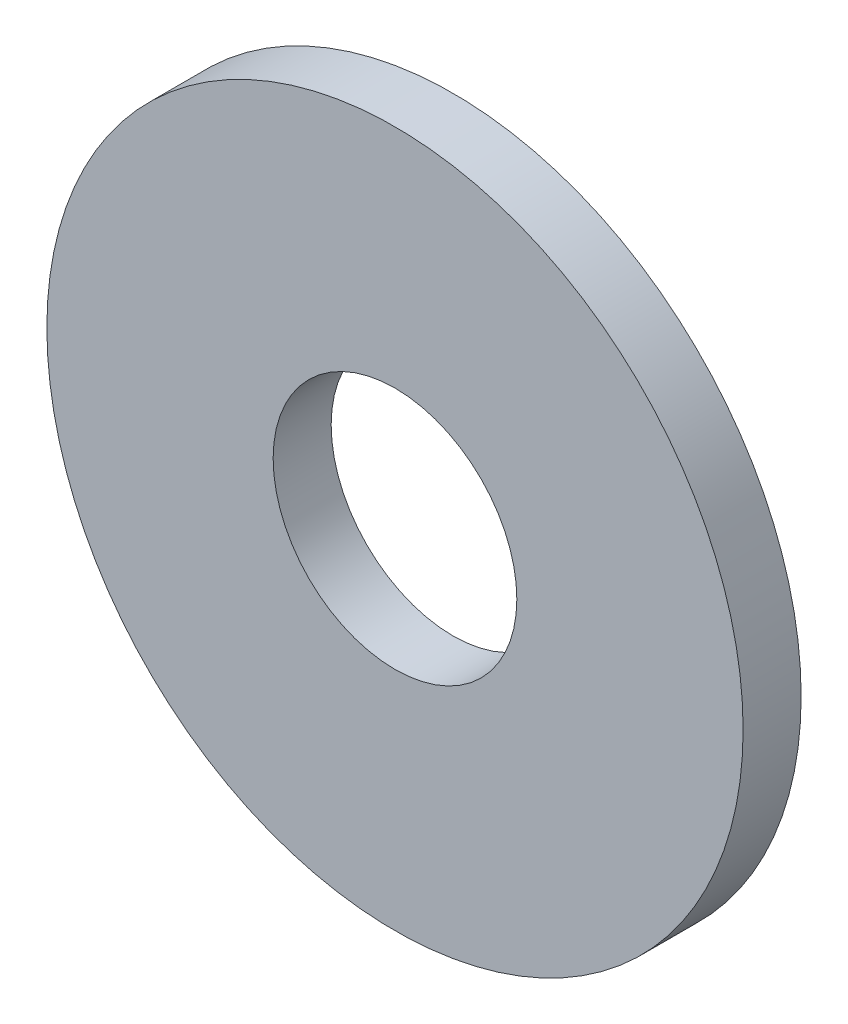
from build123d import *

# Parameters (mm, degrees)
SKETCH2_R           = 12
SKETCH2_R_2         = 4.2
BOSS_EXTRUDE1_DEPTH = 1


with BuildPart() as part:
    # Sketch2 → Boss-Extrude1 (new, symmetric)
    with BuildSketch(Plane.XY):
        Circle(SKETCH2_R)
        Circle(SKETCH2_R_2, mode=Mode.SUBTRACT)
    extrude(amount=BOSS_EXTRUDE1_DEPTH, both=True)


solid = part.part
